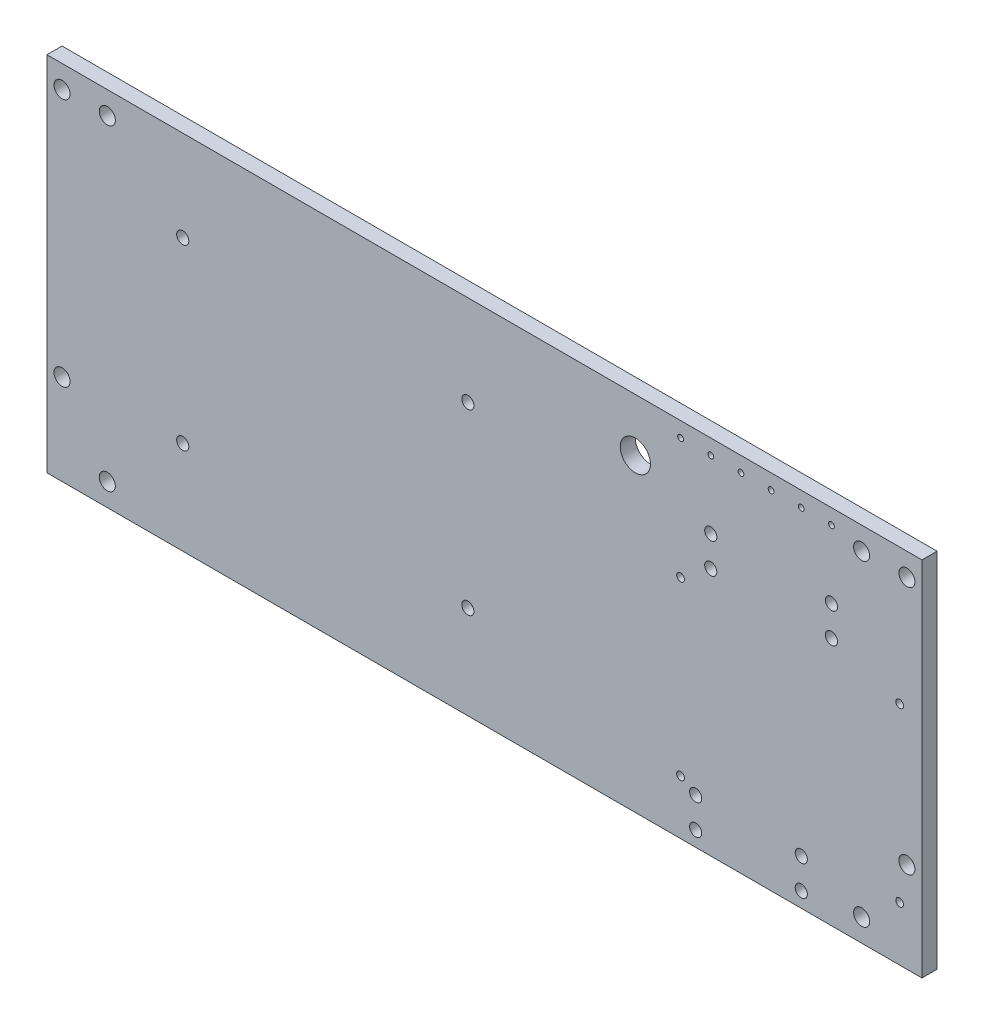
from build123d import *

# Parameters (mm, degrees)
SKETCH1_W               = 368.3
SKETCH1_H               = 152.4
BOSS_EXTRUDE1_DEPTH     = 6.35
F_4_CLEARANCE_HOLE1_D   = 3.2639
F_1_4_CLEARANCE_HOLE1_D = 6.7564
F_1_4_CLEARANCE_HOLE2_D = 6.7564
SKETCH10_R              = 6.35
CUT_EXTRUDE1_DEPTH      = 200.394044545
F_2_CLEARANCE_HOLE1_D   = 2.4384
F_10_CLEARANCE_HOLE2_D  = 5.1054
F_10_CLEARANCE_HOLE1_D  = 5.1054
F_10_CLEARANCE_HOLE3_D  = 5.1054


with BuildPart() as part:
    # Sketch1 → Boss-Extrude1 (new body)
    with BuildSketch(Plane.XY):
        Rectangle(SKETCH1_W, SKETCH1_H)
    extrude(amount=BOSS_EXTRUDE1_DEPTH)

    # #4 Clearance Hole1 (through all)
    with Locations(Plane(origin=(0, 0, 0), x_dir=(-1, 0, 0), z_dir=(0, 0, -1))):
        with Locations((-174.752, 19.05), (-82.55, -53.34), (-174.752, -53.34), (-82.55, 19.05)):
            Hole(F_4_CLEARANCE_HOLE1_D / 2)

    # 1/4 Clearance Hole1 (through all)
    with Locations(Plane(origin=(0, 0, 0), x_dir=(-1, 0, 0), z_dir=(0, 0, -1))):
        with Locations((-158.75, 66.675), (158.75, -66.675), (-158.75, -66.675), (158.75, 66.675)):
            Hole(F_1_4_CLEARANCE_HOLE1_D / 2)

    # 1/4 Clearance Hole2 (through all)
    with Locations(Plane(origin=(0, 0, 0), x_dir=(-1, 0, 0), z_dir=(0, 0, -1))):
        with Locations((-177.8, 66.675), (177.8, -38.1), (-177.8, -38.1), (177.8, 66.675)):
            Hole(F_1_4_CLEARANCE_HOLE2_D / 2)

    # Sketch10 → Cut-Extrude1 (cut, through all)
    with BuildSketch(Plane(origin=(0, 0, 0), x_dir=(-1, 0, 0), z_dir=(0, 0, -1))):
        with Locations((-63.5, 53.975)):
            Circle(SKETCH10_R)
    extrude(amount=-CUT_EXTRUDE1_DEPTH, mode=Mode.SUBTRACT)

    # #2 Clearance Hole1 (through all)
    with Locations(Plane(origin=(0, 0, 0), x_dir=(-1, 0, 0), z_dir=(0, 0, -1))):
        with Locations((-133.35, 69.85), (-146.05, 69.85), (-120.65, 69.85), (-107.95, 69.85), (-95.25, 69.85), (-82.55, 69.85)):
            Hole(F_2_CLEARANCE_HOLE1_D / 2)

    # #10 Clearance Hole2 (through all)
    with Locations(Plane(origin=(0, 0, 0), x_dir=(-1, 0, 0), z_dir=(0, 0, -1))):
        with Locations((-146.05, 41.275), (-146.05, 28.575), (-95.25, 41.275), (-95.25, 28.575)):
            Hole(F_10_CLEARANCE_HOLE2_D / 2)

    # #10 Clearance Hole1 (through all)
    with Locations(Plane(origin=(0, 0, 0), x_dir=(-1, 0, 0), z_dir=(0, 0, -1))):
        with Locations((7, 38.1), (127, -36.9), (7, -36.9), (127, 38.1)):
            Hole(F_10_CLEARANCE_HOLE1_D / 2)

    # #10 Clearance Hole3 (through all)
    with Locations(Plane(origin=(0, 0, 0), x_dir=(-1, 0, 0), z_dir=(0, 0, -1))):
        with Locations((-133.35, -57.15), (-88.9, -69.85), (-133.35, -69.85), (-88.9, -57.15)):
            Hole(F_10_CLEARANCE_HOLE3_D / 2)


solid = part.part
